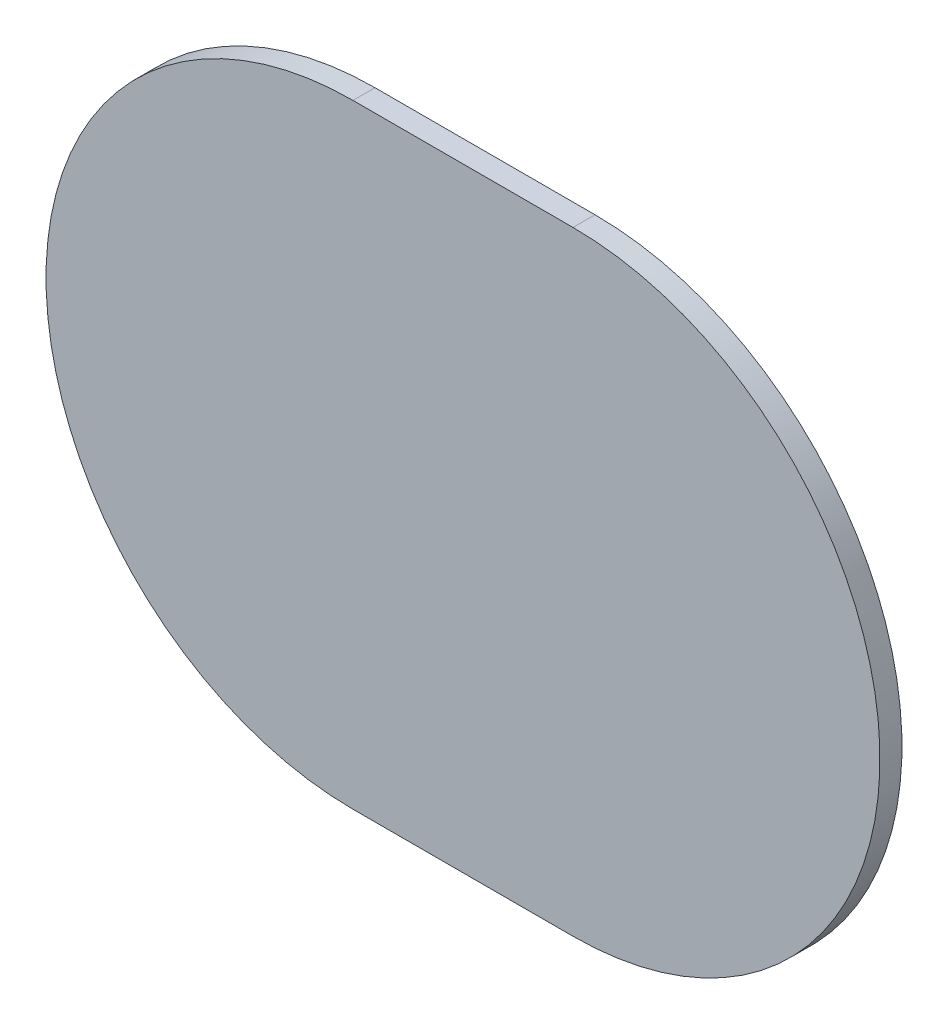
from build123d import *

# Parameters (mm, degrees)
EXTRUDE_1_DEPTH = 2


with BuildPart() as part:
    # 草图1 → 凸台-拉伸1 (new body)
    with BuildSketch(Plane.XY):
        with BuildLine():
            Line((0, 27.9), (-20, 27.9))
            ThreePointArc((-20, 27.9), (-47.9, 0), (-20, -27.9))
            Line((-20, -27.9), (0, -27.9))
            ThreePointArc((0, -27.9), (27.9, 0), (0, 27.9))
        make_face()
    extrude(amount=EXTRUDE_1_DEPTH)


solid = part.part
